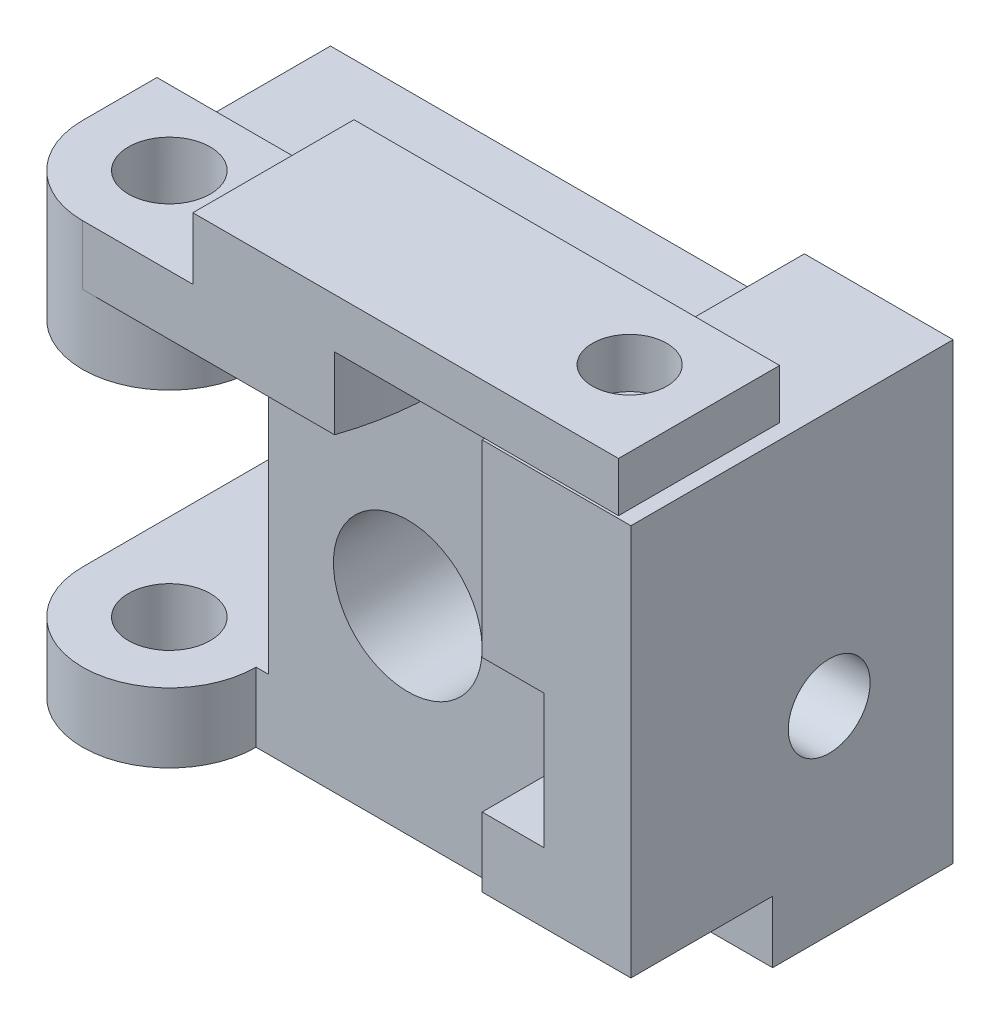
from build123d import *

# Parameters (mm, degrees)
SZKIC2_W                     = 17.619731325
SZKIC2_H                     = 16
SZKIC2_R                     = 3
DODANIE_WYCI_GNI_CIE1_DEPTH  = 10
SZKIC3_R                     = 1.65
WYTNIJ_WYCI_GNI_CIE1_DEPTH   = 10
WYTNIJ_WYCI_GNI_CIE2_DEPTH   = 2.5
DODANIE_WYCI_GNI_CIE2_DEPTH  = 2.5
SZKIC7_R                     = 1.65
DODANIE_WYCI_GNI_CIE4_DEPTH  = 2.8
SZKIC10_R                    = 1.65
DODANIE_WYCI_GNI_CIE5_DEPTH  = 2.9
SZKIC11_R                    = 1.65
DODANIE_WYCI_GNI_CIE6_DEPTH  = 2
SZKIC12_W                    = 6
SZKIC12_H                    = 13
DODANIE_WYCI_GNI_CIE7_DEPTH  = 2.3
SZKIC16_W                    = 6
SZKIC16_H                    = 3
DODANIE_WYCI_GNI_CIE12_DEPTH = 4.75
SZKIC17_W                    = 3.5
SZKIC17_H                    = 3
DODANIE_WYCI_GNI_CIE13_DEPTH = 6.5
SZKIC18_W                    = 6
SZKIC18_H                    = 3.354251662
DODANIE_WYCI_GNI_CIE14_DEPTH = 4.75
WYTNIJ_WYCI_GNI_CIE3_REACH   = 30.128
SZKIC19_R                    = 1.181229449
SZKIC21_W                    = 2.5
SZKIC21_H                    = 0.556642191
DODANIE_WYCI_GNI_CIE15_DEPTH = 11.418457
WYTNIJ_WYCI_GNI_CIE4_START   = -18.3
SZKIC22_R                    = 1.181229449
WYTNIJ_WYCI_GNI_CIE4_DEPTH   = 18.3
SZKIC34_W                    = 7.949380073
SZKIC34_H                    = 6.5
WYTNIJ_WYCI_GNI_CIE5_DEPTH   = 2.5
SZKIC35_W                    = 6.6400164
SZKIC35_H                    = 5.717036495
WYTNIJ_WYCI_GNI_CIE6_DEPTH   = 2.5
SZKIC36_R                    = 1.5
WYTNIJ_WYCI_GNI_CIE7_DEPTH   = 21


with BuildPart() as part:
    # Szkic2 → Dodanie-wyciągnięcie1 (new body)
    with BuildSketch(Plane.XY):
        with Locations((3.190134337, 0)):
            Rectangle(SZKIC2_W, SZKIC2_H)
        Circle(SZKIC2_R, mode=Mode.SUBTRACT)
    extrude(amount=DODANIE_WYCI_GNI_CIE1_DEPTH)

    # Szkic3 → Wytnij-wyciągnięcie1 (cut)
    with BuildSketch(Plane(origin=(12, 0, 0), x_dir=(0, 0, -1), z_dir=(1, 0, 0))):
        with Locations(Location((-5, 0, 0), (0, 0, 90))):
            Circle(SZKIC3_R)
    extrude(amount=-WYTNIJ_WYCI_GNI_CIE1_DEPTH, mode=Mode.SUBTRACT)

    # Szkic5 → Wytnij-wyciągnięcie2 (cut)
    with BuildSketch(Plane(origin=(6, 0, 0), x_dir=(0, 0, -1), z_dir=(1, 0, 0))):
        Polygon((-8.418457275, 3.25), (-10, 3.25), (-10, -3.25), (-8.418457275, -3.25), (-1.581542725, -3.25), (-1.581542725, 3.25), align=None)
    extrude(amount=WYTNIJ_WYCI_GNI_CIE2_DEPTH, mode=Mode.SUBTRACT)

    # Szkic6 → Dodanie-wyciągnięcie2 (add)
    with BuildSketch(Plane(origin=(6, 0, 0), x_dir=(0, 0, -1), z_dir=(1, 0, 0))):
        Polygon((-1.591079408, 3.256272654), (-1.591079408, 0.295576336), (-3.210214166, 3.1), (-3.210214166, 3.256272654), align=None)
    dodanie_wyci_gni_cie2 = extrude(amount=DODANIE_WYCI_GNI_CIE2_DEPTH)

    # Lustro1: Dodanie-wyciągnięcie2 across plane
    add(dodanie_wyci_gni_cie2.mirror(Plane.ZX))

    # Szkic7 → Dodanie-wyciągnięcie4 (add)
    with BuildSketch(Plane.XZ.offset(8)):
        with BuildLine():
            Line((-13.119731325, 10), (-13.119731325, 0))
            Line((-13.119731325, 0), (-5.619731325, 0))
            Line((-5.619731325, 0), (-5.619731325, 10))
            Line((-5.619731325, 10), (-6.119731325, 10))
            ThreePointArc((-6.119731325, 10), (-9.619731325, 13.5), (-13.119731325, 10))
        make_face()
        with Locations(Location((-9.619731325, 10, 0), (0, 0, 270))):
            Circle(SZKIC7_R, mode=Mode.SUBTRACT)
    dodanie_wyci_gni_cie4 = extrude(amount=-DODANIE_WYCI_GNI_CIE4_DEPTH)

    # Lustro2: Dodanie-wyciągnięcie4 across plane
    add(dodanie_wyci_gni_cie4.mirror(Plane.ZX))

    # Szkic10 → Dodanie-wyciągnięcie5 (add)
    with BuildSketch(Plane(origin=(0, 8, 0), x_dir=(1, 0, 0), z_dir=(0, 1, 0))):
        with BuildLine():
            Line((-6.119731325, -13.5), (0.54454435, -13.5))
            ThreePointArc((0.54454435, -13.5), (1.127068602, -10.262281002), (0.703180086, -7))
            Line((0.703180086, -7), (-6.119731325, -7))
            Line((-6.119731325, -7), (-13.119731325, -7))
            Line((-13.119731325, -7), (-13.119731325, -10))
            ThreePointArc((-13.119731325, -10), (-12.094605059, -12.474873734), (-9.619731325, -13.5))
            Line((-9.619731325, -13.5), (-6.119731325, -13.5))
        make_face()
        with Locations(Location((-9.619731325, -10, 0), (0, 0, 90))):
            Circle(SZKIC10_R, mode=Mode.SUBTRACT)
    extrude(amount=DODANIE_WYCI_GNI_CIE5_DEPTH)

    # Szkic11 → Dodanie-wyciągnięcie6 (add)
    with BuildSketch(Plane(origin=(0, 10.9, 0), x_dir=(1, 0, 0), z_dir=(0, 1, 0))):
        with BuildLine():
            Line((12, -7), (-13.119731325, -7))
            Line((-13.119731325, -7), (-13.119731325, -10))
            ThreePointArc((-13.119731325, -10), (-12.094605059, -12.474873734), (-9.619731325, -13.5))
            Line((-9.619731325, -13.5), (12, -13.5))
            Line((12, -13.5), (12, -7))
        make_face()
        with Locations(Location((-9.619731325, -10, 0), (0, 0, 90))):
            Circle(SZKIC11_R, mode=Mode.SUBTRACT)
    extrude(amount=DODANIE_WYCI_GNI_CIE6_DEPTH)

    # Szkic12 → Dodanie-wyciągnięcie7 (add)
    with BuildSketch(Plane(origin=(0, 8, 0), x_dir=(1, 0, 0), z_dir=(0, 1, 0))):
        with Locations((9, -6.5)):
            Rectangle(SZKIC12_W, SZKIC12_H)
    extrude(amount=DODANIE_WYCI_GNI_CIE7_DEPTH)

    # Szkic16 → Dodanie-wyciągnięcie12 (add)
    with BuildSketch(Plane.XZ.offset(-8)):
        with Locations((9, 11.5)):
            Rectangle(SZKIC16_W, SZKIC16_H)
    extrude(amount=DODANIE_WYCI_GNI_CIE12_DEPTH)

    # Szkic17 → Dodanie-wyciągnięcie13 (add)
    with BuildSketch(Plane.XZ.offset(-3.25)):
        with Locations((10.25, 11.5)):
            Rectangle(SZKIC17_W, SZKIC17_H)
    extrude(amount=DODANIE_WYCI_GNI_CIE13_DEPTH)

    # Szkic18 → Dodanie-wyciągnięcie14 (add)
    with BuildSketch(Plane.XZ.offset(3.25)):
        with Locations((9, 11.322874169)):
            Rectangle(SZKIC18_W, SZKIC18_H)
    extrude(amount=DODANIE_WYCI_GNI_CIE14_DEPTH)

    # Wytnij-wyciągnięcie3: up to this face of the body (flat: up to its plane)
    wytnij_wyci_gni_cie3_end = Plane(part.part.faces().sort_by_distance((-0.291063064, -8, 5.711108324))[0])
    # Szkic19 → Wytnij-wyciągnięcie3 (cut, up to the picked face)
    with BuildSketch(Plane(origin=(0, 12.9, 0), x_dir=(1, 0, 0), z_dir=(0, 1, 0)), mode=Mode.PRIVATE) as wytnij_wyci_gni_cie3_sk1:
        with Locations(Location((9, -10, 0), (0, 0, 270))):
            Circle(SZKIC19_R)
    wytnij_wyci_gni_cie3_tool1 = split(extrude(wytnij_wyci_gni_cie3_sk1.sketch, amount=-WYTNIJ_WYCI_GNI_CIE3_REACH, mode=Mode.PRIVATE), bisect_by=wytnij_wyci_gni_cie3_end, keep=Keep.BOTH, mode=Mode.PRIVATE)
    add(wytnij_wyci_gni_cie3_tool1.solids().sort_by(Axis((9, 12.9, 10), (0, -1, 0)))[0], mode=Mode.SUBTRACT)

    # Szkic21 → Dodanie-wyciągnięcie15 (add)
    with BuildSketch(Plane.XY.offset(1.581542725)):
        with Locations((7.25, 2.978321096)):
            Rectangle(SZKIC21_W, SZKIC21_H)
    dodanie_wyci_gni_cie15 = extrude(amount=DODANIE_WYCI_GNI_CIE15_DEPTH)

    # Lustro3: Dodanie-wyciągnięcie15 across plane
    add(dodanie_wyci_gni_cie15.mirror(Plane.ZX))

    # Szkic22 → Wytnij-wyciągnięcie4 (cut)
    with BuildSketch(Plane.XZ.offset(8).offset(WYTNIJ_WYCI_GNI_CIE4_START)):
        with Locations(Location((9, 10, 0), (0, 0, 90))):
            Circle(SZKIC22_R)
    extrude(amount=WYTNIJ_WYCI_GNI_CIE4_DEPTH, mode=Mode.SUBTRACT)

    # Szkic34 → Wytnij-wyciągnięcie5 (cut)
    with BuildSketch(Plane(origin=(0, 12.9, 0), x_dir=(1, 0, 0), z_dir=(0, 1, 0))):
        with Locations((-9.145041288, -10.25)):
            Rectangle(SZKIC34_W, SZKIC34_H)
    extrude(amount=-WYTNIJ_WYCI_GNI_CIE5_DEPTH, mode=Mode.SUBTRACT)

    # Szkic35 → Wytnij-wyciągnięcie6 (cut)
    with BuildSketch(Plane.XZ.offset(8)):
        with Locations((8.6799918, 10.141481753)):
            Rectangle(SZKIC35_W, SZKIC35_H)
    extrude(amount=-WYTNIJ_WYCI_GNI_CIE6_DEPTH, mode=Mode.SUBTRACT)

    # Szkic36 → Wytnij-wyciągnięcie7 (cut)
    with BuildSketch(Plane(origin=(0, 15, 0), x_dir=(1, 0, 0), z_dir=(0, 1, 0))):
        with Locations(Location((8.94965168, -10.000267868, 0), (0, 0, 270))):
            Circle(SZKIC36_R)
    extrude(amount=-WYTNIJ_WYCI_GNI_CIE7_DEPTH, mode=Mode.SUBTRACT)


solid = part.part
